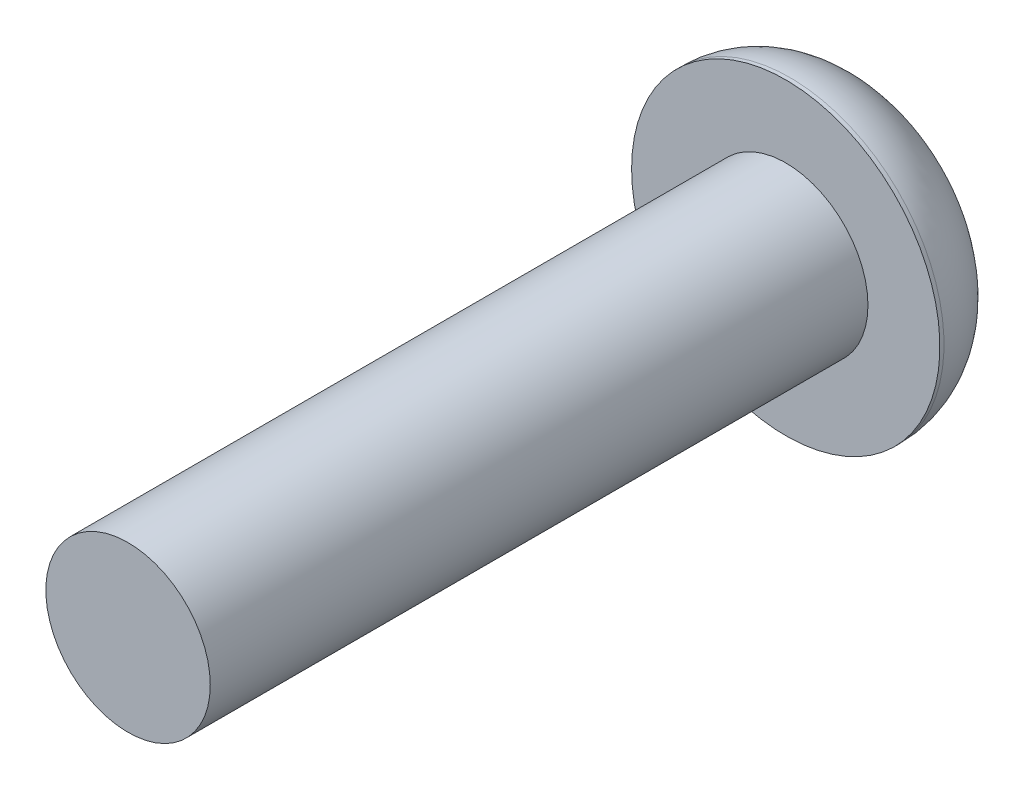
from build123d import *

# Parameters (mm, degrees)
SKETCH_1_R      = 2
EXTRUDE_1_DEPTH = 16
SKETCH_2_R      = 3.75
EXTRUDE_2_DEPTH = 2.1
FILLET_1_R      = 2


with BuildPart() as part:
    # 草图1 → 凸台-拉伸1 (new body)
    with BuildSketch(Plane.XY):
        Circle(SKETCH_1_R)
    extrude(amount=EXTRUDE_1_DEPTH)

    # 草图2 → 凸台-拉伸2 (add)
    with BuildSketch(Plane(origin=(0, 0, 0), x_dir=(-1, 0, 0), z_dir=(0, 0, -1))):
        Circle(SKETCH_2_R)
    extrude(amount=EXTRUDE_2_DEPTH)

    # 圆角1
    fillet_1_edges = [part.edges().sort_by_distance(p)[0] for p in [
        (3.75, 0, -2.1),
    ]]
    fillet(fillet_1_edges, radius=FILLET_1_R)


solid = part.part
